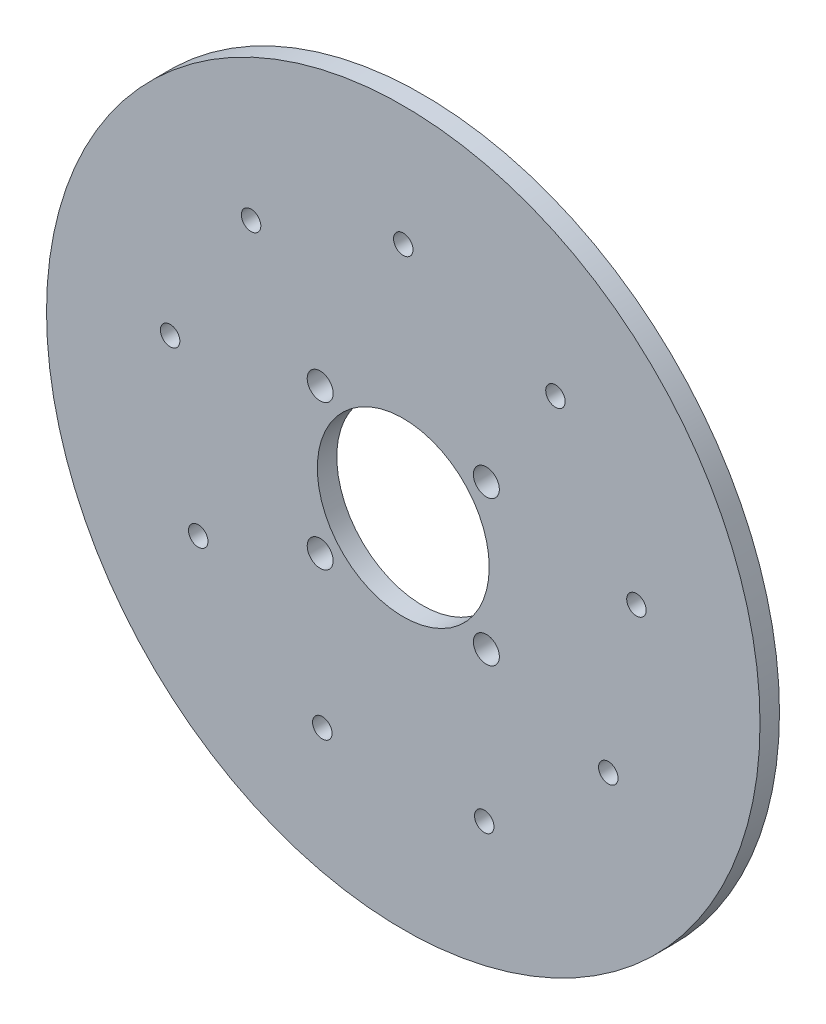
from build123d import *

# Parameters (mm, degrees)
SKETCH_1_R      = 55
SKETCH_1_R_2    = 1.5
SKETCH_1_R_3    = 13.25
SKETCH_1_R_4    = 2
EXTRUDE_1_DEPTH = 3


with BuildPart() as part:
    # 草图1 → 凸台-拉伸1 (new body)
    with BuildSketch(Plane.XY):
        Circle(SKETCH_1_R)
        with Locations((0, 36.5)):
            Circle(SKETCH_1_R_2, mode=Mode.SUBTRACT)
        with Locations((23.461747754, 27.960622174)):
            Circle(SKETCH_1_R_2, mode=Mode.SUBTRACT)
        with Locations((35.945482985, 6.338158485)):
            Circle(SKETCH_1_R_2, mode=Mode.SUBTRACT)
        with Locations((31.609927238, -18.25)):
            Circle(SKETCH_1_R_2, mode=Mode.SUBTRACT)
        with Locations((12.483735231, -34.298780659)):
            Circle(SKETCH_1_R_2, mode=Mode.SUBTRACT)
        with Locations((-12.483735231, -34.298780659)):
            Circle(SKETCH_1_R_2, mode=Mode.SUBTRACT)
        with Locations((-31.609927238, -18.25)):
            Circle(SKETCH_1_R_2, mode=Mode.SUBTRACT)
        with Locations((-35.945482985, 6.338158485)):
            Circle(SKETCH_1_R_2, mode=Mode.SUBTRACT)
        with Locations((-23.461747754, 27.960622174)):
            Circle(SKETCH_1_R_2, mode=Mode.SUBTRACT)
        Circle(SKETCH_1_R_3, mode=Mode.SUBTRACT)
        with Locations((-12.809350268, 11.176786018)):
            Circle(SKETCH_1_R_4, mode=Mode.SUBTRACT)
        with Locations(Location((12.809350268, 11.176786018, 0), (0, 0, 180))):
            Circle(SKETCH_1_R_4, mode=Mode.SUBTRACT)
        with Locations((12.809350268, -11.176786018)):
            Circle(SKETCH_1_R_4, mode=Mode.SUBTRACT)
        with Locations(Location((-12.809350268, -11.176786018, 0), (0, 0, 180))):
            Circle(SKETCH_1_R_4, mode=Mode.SUBTRACT)
    extrude(amount=EXTRUDE_1_DEPTH)


solid = part.part
